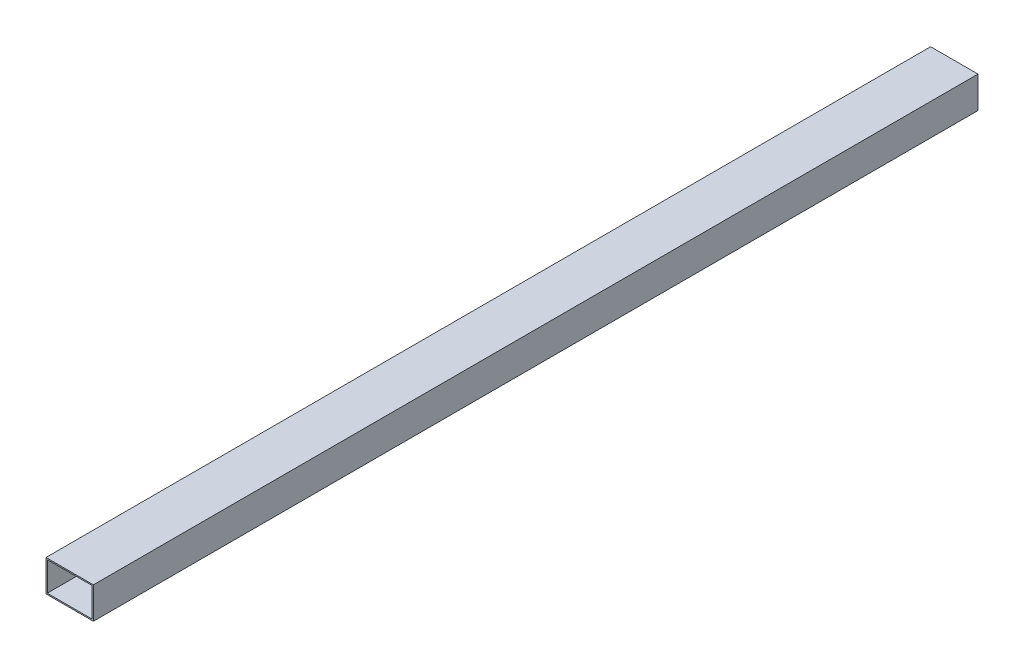
from build123d import *

# Parameters (mm, degrees)
CROQUIS1_W              = 150
CROQUIS1_H              = 100
CROQUIS1_W_2            = 142
CROQUIS1_H_2            = 92
SALIENTE_EXTRUIR2_DEPTH = 2800


with BuildPart() as part:
    # Croquis1 → Saliente-Extruir2 (new body)
    with BuildSketch(Plane.XY):
        with Locations((-32.863012306, -18.62925801)):
            Rectangle(CROQUIS1_W, CROQUIS1_H)
        with Locations((-32.863012306, -18.62925801)):
            Rectangle(CROQUIS1_W_2, CROQUIS1_H_2, mode=Mode.SUBTRACT)
    extrude(amount=SALIENTE_EXTRUIR2_DEPTH)


solid = part.part
